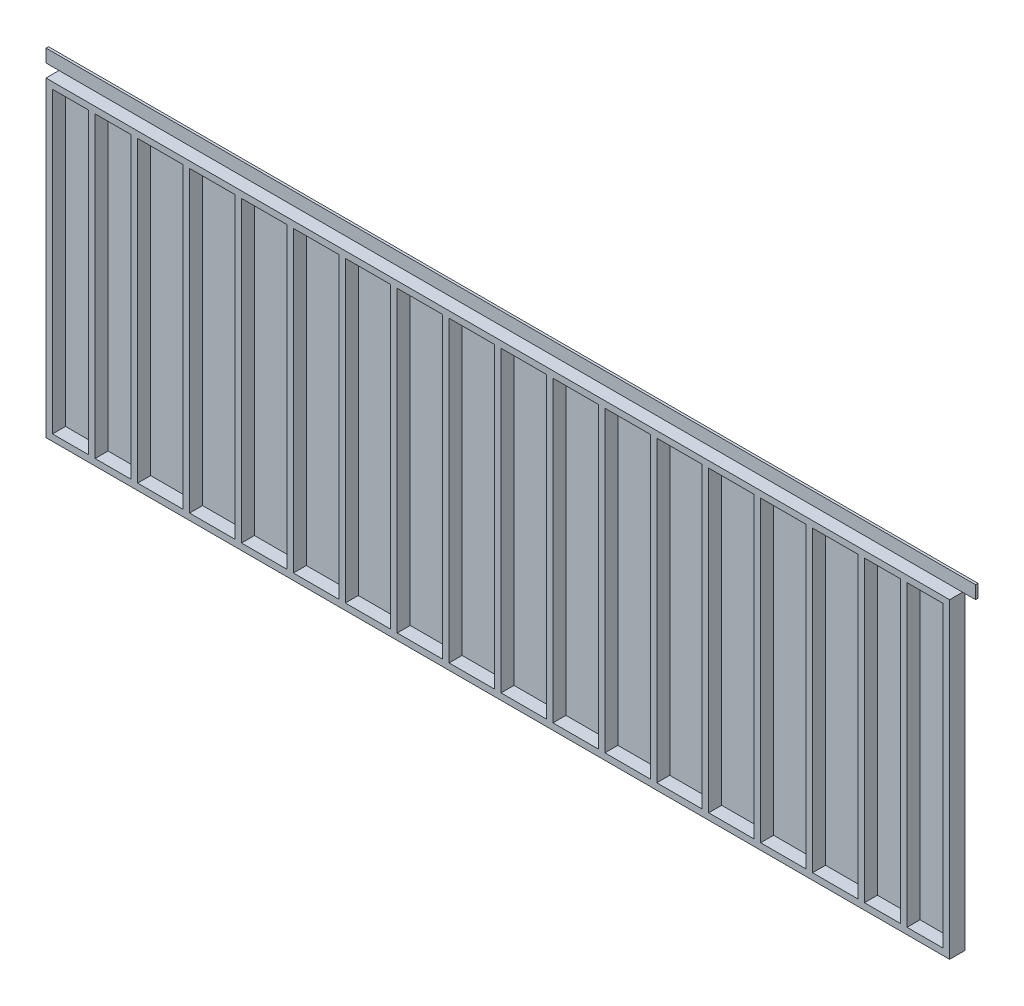
from build123d import *

# Parameters (mm, degrees)
SKETCH1_W           = 355.6
SKETCH1_H           = 2336.8
SKETCH1_W_2         = 282.575
BOSS_EXTRUDE1_DEPTH = 101.6
SKETCH2_W           = 7073.9
SKETCH2_H           = 2438.4
BOSS_EXTRUDE2_DEPTH = 19.05
BOSS_EXTRUDE3_DEPTH = 19.05


with BuildPart() as part:
    # Sketch1 → Boss-Extrude1 (new body)
    with BuildSketch(Plane.XY):
        Polygon((0, 0), (3536.95, 0), (3536.95, 2438.4), (-3536.95, 2438.4), (-3536.95, 0), align=None)
        with Locations((203.2, 1219.2)):
            Rectangle(SKETCH1_W, SKETCH1_H, mode=Mode.SUBTRACT)
        with Locations((-203.2, 1219.2)):
            Rectangle(SKETCH1_W, SKETCH1_H, mode=Mode.SUBTRACT)
        with Locations((609.6, 1219.2)):
            Rectangle(SKETCH1_W, SKETCH1_H, mode=Mode.SUBTRACT)
        with Locations((1016, 1219.2)):
            Rectangle(SKETCH1_W, SKETCH1_H, mode=Mode.SUBTRACT)
        with Locations((-3344.8625, 1219.2)):
            Rectangle(SKETCH1_W_2, SKETCH1_H, mode=Mode.SUBTRACT)
        with Locations((3344.8625, 1219.2)):
            Rectangle(SKETCH1_W_2, SKETCH1_H, mode=Mode.SUBTRACT)
        with Locations((1422.4, 1219.2)):
            Rectangle(SKETCH1_W, SKETCH1_H, mode=Mode.SUBTRACT)
        with Locations((1828.8, 1219.2)):
            Rectangle(SKETCH1_W, SKETCH1_H, mode=Mode.SUBTRACT)
        with Locations((2235.2, 1219.2)):
            Rectangle(SKETCH1_W, SKETCH1_H, mode=Mode.SUBTRACT)
        with Locations((2641.6, 1219.2)):
            Rectangle(SKETCH1_W, SKETCH1_H, mode=Mode.SUBTRACT)
        with Locations((3011.4875, 1219.2)):
            Rectangle(SKETCH1_W_2, SKETCH1_H, mode=Mode.SUBTRACT)
        with Locations((-609.6, 1219.2)):
            Rectangle(SKETCH1_W, SKETCH1_H, mode=Mode.SUBTRACT)
        with Locations((-1016, 1219.2)):
            Rectangle(SKETCH1_W, SKETCH1_H, mode=Mode.SUBTRACT)
        with Locations((-1422.4, 1219.2)):
            Rectangle(SKETCH1_W, SKETCH1_H, mode=Mode.SUBTRACT)
        with Locations((-1828.8, 1219.2)):
            Rectangle(SKETCH1_W, SKETCH1_H, mode=Mode.SUBTRACT)
        with Locations((-2235.2, 1219.2)):
            Rectangle(SKETCH1_W, SKETCH1_H, mode=Mode.SUBTRACT)
        with Locations((-2641.6, 1219.2)):
            Rectangle(SKETCH1_W, SKETCH1_H, mode=Mode.SUBTRACT)
        with Locations((-3011.4875, 1219.2)):
            Rectangle(SKETCH1_W_2, SKETCH1_H, mode=Mode.SUBTRACT)
    extrude(amount=BOSS_EXTRUDE1_DEPTH)

    # Sketch2 → Boss-Extrude2 (add)
    with BuildSketch(Plane(origin=(0, 0, 0), x_dir=(-1, 0, 0), z_dir=(0, 0, -1))):
        with Locations((0, 1219.2)):
            Rectangle(SKETCH2_W, SKETCH2_H)
    extrude(amount=BOSS_EXTRUDE2_DEPTH)

    # Sketch3 → Boss-Extrude3 (add)
    with BuildSketch(Plane(origin=(0, 0, -19.05), x_dir=(-1, 0, 0), z_dir=(0, 0, -1))):
        Polygon((-3536.95, 2438.4), (-3638.55, 2438.4), (-3638.55, 2540), (3638.55, 2540), (3638.55, 2438.4), (3536.95, 2438.4), align=None)
    extrude(amount=-BOSS_EXTRUDE3_DEPTH)


solid = part.part
